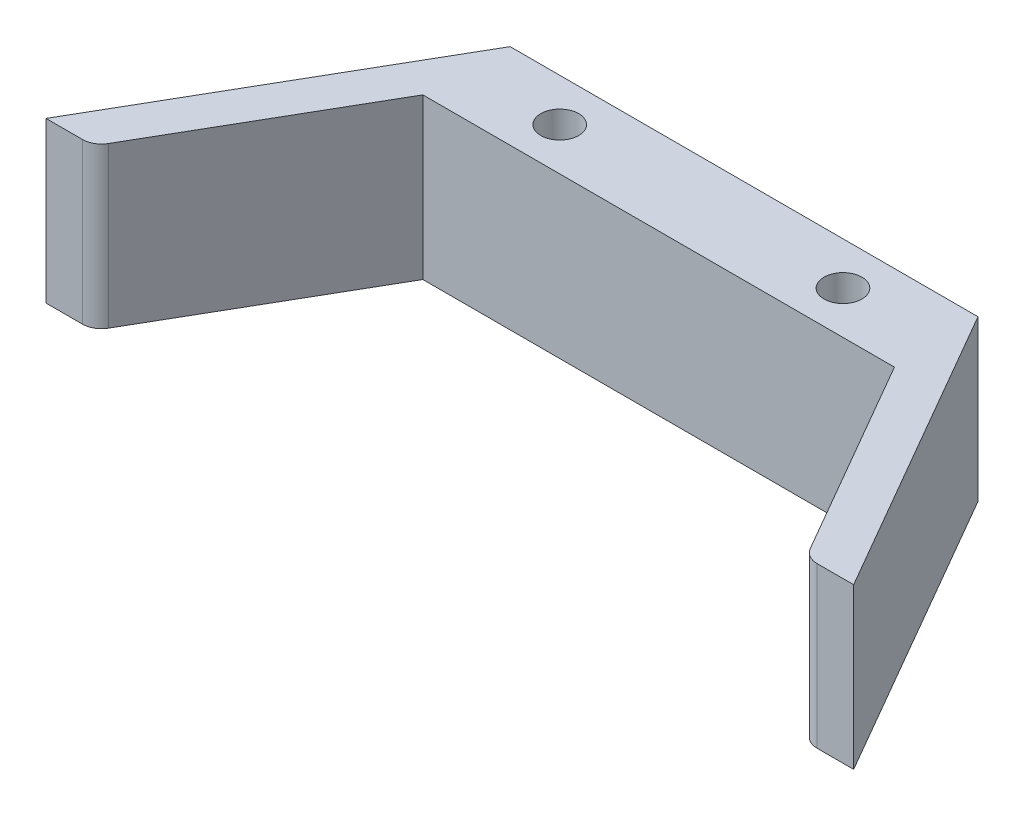
from build123d import *

# Parameters (mm, degrees)
SKETCH1_R           = 2
BOSS_EXTRUDE1_DEPTH = 16.85


with BuildPart() as part:
    # Sketch1 → Boss-Extrude1 (new body)
    # profile 1 of 4: a face of its own
    with BuildSketch(Plane(origin=(0, 0, 0), x_dir=(1, 0, 0), z_dir=(0, 1, 0))):
        Polygon((-24.645, 9), (-29.841152423, 0), (-24.841152423, 0), (0, 0), (0, 9), align=None)
        with Locations(Location((-14.92, 4.5, 0), (0, 0, 270))):
            Circle(SKETCH1_R, mode=Mode.SUBTRACT)
    # profile 2 of 4: a face of its own
    with BuildSketch(Plane(origin=(0, 0, 0), x_dir=(1, 0, 0), z_dir=(0, 1, 0))):
        Polygon((0, 9), (0, 0), (24.841152423, 0), (29.841152423, 0), (24.645, 9), align=None)
        with Locations(Location((14.92, 4.5, 0), (0, 0, 270))):
            Circle(SKETCH1_R, mode=Mode.SUBTRACT)
    # profile 3 of 4: a face of its own
    with BuildSketch(Plane(origin=(0, 0, 0), x_dir=(1, 0, 0), z_dir=(0, 1, 0))):
        with BuildLine():
            Line((-24.841152423, 0), (-29.841152423, 0))
            Line((-29.841152423, 0), (-42.542858345, -22))
            Line((-42.542858345, -22), (-38.697558883, -22))
            ThreePointArc((-38.697558883, -22), (-37.697558883, -21.732050808), (-36.965508076, -21))
            Line((-36.965508076, -21), (-24.841152423, 0))
        make_face()
    # profile 4 of 4: a face of its own
    with BuildSketch(Plane(origin=(0, 0, 0), x_dir=(1, 0, 0), z_dir=(0, 1, 0))):
        with BuildLine():
            Line((29.841152423, 0), (24.841152423, 0))
            Line((24.841152423, 0), (36.965508076, -21))
            ThreePointArc((36.965508076, -21), (37.697558883, -21.732050808), (38.697558883, -22))
            Line((38.697558883, -22), (42.542858345, -22))
            Line((42.542858345, -22), (29.841152423, 0))
        make_face()
    extrude(amount=BOSS_EXTRUDE1_DEPTH)


solid = part.part
